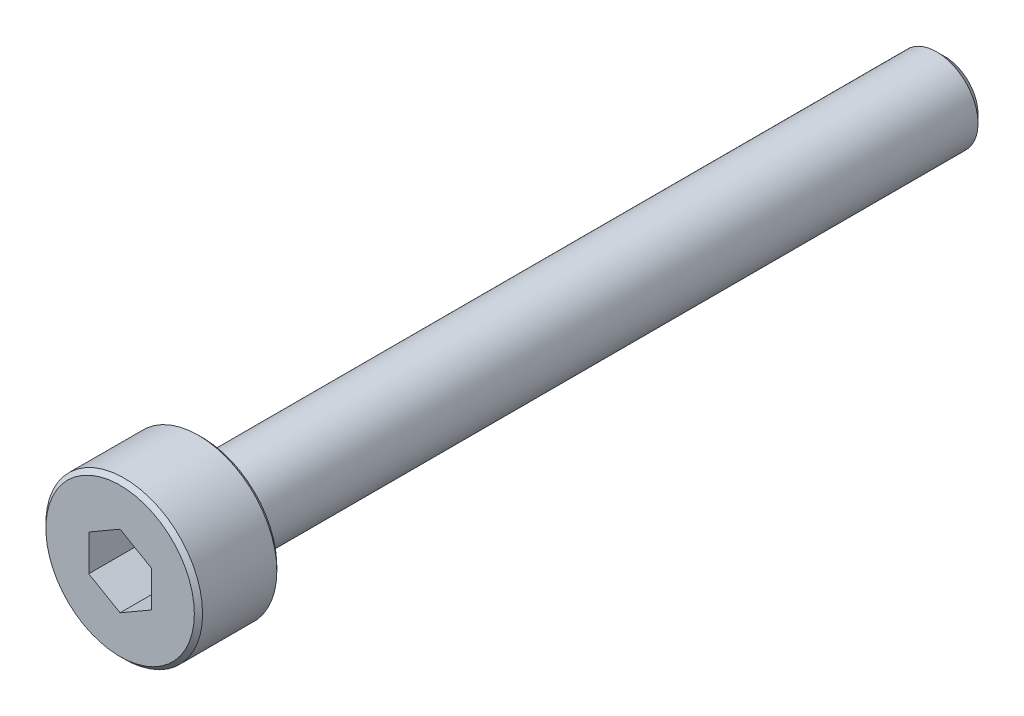
from build123d import *

# Parameters (mm, degrees)
SKETCH_1_W          = 1.9
SKETCH_1_H          = 2
SKETCH_2_R          = 1
EXTRUDE_1_DEPTH     = 18
CUT_EXTRUDE_1_DEPTH = 1.5
CHAMFER_1_SIZE2     = 0.100000822
CHAMFER_1_SIZE      = 0.100000763
CHAMFER_2_SIZE      = 0.200008364
CHAMFER_2_SIZE2     = 0.200010455


with BuildPart() as part:
    # 草图1 → 旋转1 (revolve)
    with BuildSketch(Plane(origin=(0, 0, 0), x_dir=(1, 0, 0), z_dir=(0, 1, 0))):
        with Locations((0.95, -11)):
            Rectangle(SKETCH_1_W, SKETCH_1_H)
    revolve(axis=Axis((0, 0, 10), (0, 0, 1)))

    # 草图2 → 凸台-拉伸1 (add)
    with BuildSketch(Plane(origin=(0, 0, 10), x_dir=(-1, 0, 0), z_dir=(0, 0, -1))):
        Circle(SKETCH_2_R)
    extrude(amount=EXTRUDE_1_DEPTH)

    # 草图3 → 切除-拉伸1 (cut)
    with BuildSketch(Plane.XY.offset(12)):
        Polygon((-0.76, -0.438786205), (0, -0.877572409), (0.76, -0.438786205), (0.76, 0.438786205), (0, 0.877572409), (-0.76, 0.438786205), align=None)
    extrude(amount=-CUT_EXTRUDE_1_DEPTH, mode=Mode.SUBTRACT)

    # 倒角1
    chamfer_1_edges = [part.edges().sort_by_distance(p)[0] for p in [
        (-1.9, 0, 12),
        (-1.9, 0, 10),
    ]]
    chamfer(chamfer_1_edges, length=CHAMFER_1_SIZE, length2=CHAMFER_1_SIZE2)

    # 倒角2
    chamfer_2_edges = [part.edges().sort_by_distance(p)[0] for p in [
        (1, 0, -8),
    ]]
    chamfer_2_side = [part.faces().sort_by_distance(p)[0] for p in [
        (1, 0, 1),
    ]]
    chamfer(chamfer_2_edges, length=CHAMFER_2_SIZE, length2=CHAMFER_2_SIZE2, reference=chamfer_2_side[0])


solid = part.part
